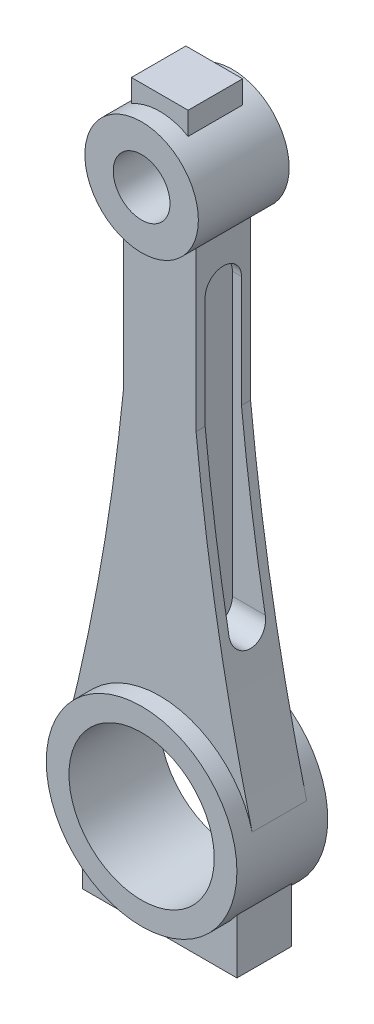
from build123d import *

# Parameters (mm, degrees)
SKETCH2_R             = 12.5
SKETCH2_R_2           = 6.25
BOSS_EXTRUDE1_DEPTH   = 10
SKETCH2_R_3           = 21
SKETCH2_R_4           = 16
BOSS_EXTRUDE1_2_DEPTH = 10
BOSS_EXTRUDE2_DEPTH   = 6
CUT_EXTRUDE1_START    = -6
CUT_EXTRUDE1_DEPTH    = 132.802456026
CUT_EXTRUDE4_START    = 6
CUT_EXTRUDE4_DEPTH    = 132.802456026


with BuildPart() as part:
    # Sketch2 → Boss-Extrude1 (new, symmetric)
    with BuildSketch(Plane.XY):
        with Locations((0, 120)):
            Circle(SKETCH2_R)
        with Locations((0, 120)):
            Circle(SKETCH2_R_2, mode=Mode.SUBTRACT)
    extrude(amount=BOSS_EXTRUDE1_DEPTH, both=True)



with BuildPart() as body_2:
    # Sketch2 → Boss-Extrude1 2 (new, symmetric)
    with BuildSketch(Plane.XY):
        Circle(SKETCH2_R_3)
        Circle(SKETCH2_R_4, mode=Mode.SUBTRACT)
    extrude(amount=BOSS_EXTRUDE1_2_DEPTH, both=True)


with BuildPart() as part_1:
    add(part.part)

    add(body_2.part)  # Boss-Extrude2 merges body 2
    # Sketch2<3> → Boss-Extrude2 (add, symmetric)
    with BuildSketch(Plane.XY):
        with BuildLine():
            ThreePointArc((8, 110.395313644), (0, 107.5), (-8, 110.395313644))
            Line((-8, 110.395313644), (-8, 75.395313644))
            ThreePointArc((-8, 75.395313644), (-12.871500282, 40.050257874), (-20.354994984, 5.164705142))
            ThreePointArc((-20.354994984, 5.164705142), (0, 21), (20.354994984, 5.164705142))
            ThreePointArc((20.354994984, 5.164705142), (12.871500282, 40.050257874), (8, 75.395313644))
            Line((8, 75.395313644), (8, 110.395313644))
        make_face()
        with BuildLine():
            Line((-6.25, 135.825317547), (-6.25, 130.825317547))
            ThreePointArc((-6.25, 130.825317547), (0, 132.5), (6.25, 130.825317547))
            Line((6.25, 130.825317547), (6.25, 135.825317547))
            Line((6.25, 135.825317547), (-6.25, 135.825317547))
        make_face()
        with BuildLine():
            ThreePointArc((17, -12.328828006), (0, -21), (-17, -12.328828006))
            Line((-17, -12.328828006), (-17, -24.328828006))
            Line((-17, -24.328828006), (17, -24.328828006))
            Line((17, -24.328828006), (17, -12.328828006))
        make_face()
    extrude(amount=BOSS_EXTRUDE2_DEPTH, both=True)

    # Sketch4 → Cut-Extrude1 (cut, through all)
    with BuildSketch(Plane(origin=(0, 0, 0), x_dir=(0, 0, -1), z_dir=(1, 0, 0)).offset(CUT_EXTRUDE1_START)):
        with BuildLine():
            Line((4, 100), (4, 38))
            ThreePointArc((4, 38), (0, 34), (-4, 38))
            Line((-4, 38), (-4, 100))
            ThreePointArc((-4, 100), (0, 104), (4, 100))
        make_face()
    extrude(amount=-CUT_EXTRUDE1_DEPTH, mode=Mode.SUBTRACT)

    # Sketch4<4> → Cut-Extrude4 (cut, through all)
    with BuildSketch(Plane(origin=(0, 0, 0), x_dir=(0, 0, -1), z_dir=(1, 0, 0)).offset(CUT_EXTRUDE4_START)):
        with BuildLine():
            Line((4, 100), (4, 38))
            ThreePointArc((4, 38), (0, 34), (-4, 38))
            Line((-4, 38), (-4, 100))
            ThreePointArc((-4, 100), (0, 104), (4, 100))
        make_face()
    extrude(amount=CUT_EXTRUDE4_DEPTH, mode=Mode.SUBTRACT)


solid = part_1.part
